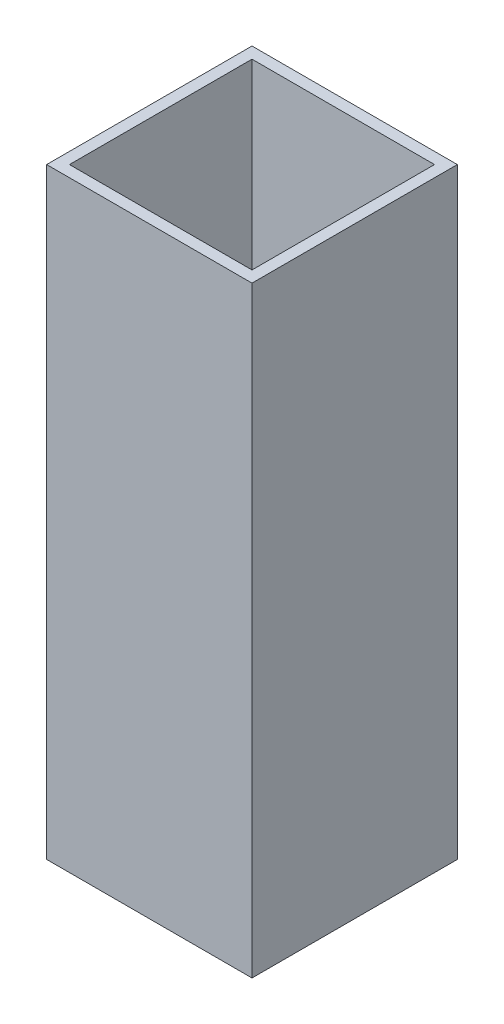
from build123d import *

# Parameters (mm, degrees)
SKETCH1_W            = 36
SKETCH1_H            = 36
SKETCH1_W_2          = 32
SKETCH1_H_2          = 32
BOSS_EXTRUDE1_DEPTH  = 10
SKETCH5_W            = 36
SKETCH5_H            = 36
SKETCH5_W_2          = 32
SKETCH5_H_2          = 32
BOSS_EXTRUDE5_DEPTH  = 63.5
SKETCH2_W            = 36
SKETCH2_H            = 36
SKETCH2_W_2          = 28
SKETCH2_H_2          = 28
BOSS_EXTRUDE9_DEPTH  = 2
SKETCH9_W            = 36
SKETCH9_H            = 36
SKETCH9_W_2          = 32
SKETCH9_H_2          = 32
BOSS_EXTRUDE11_DEPTH = 30


with BuildPart() as part:
    # Sketch1 → Boss-Extrude1 (new body)
    with BuildSketch(Plane(origin=(0, 0, 0), x_dir=(1, 0, 0), z_dir=(0, 1, 0))):
        with Locations((-61.04447382, 32.009277239)):
            Rectangle(SKETCH1_W, SKETCH1_H)
        with Locations((-61.04447382, 32.009277239)):
            Rectangle(SKETCH1_W_2, SKETCH1_H_2, mode=Mode.SUBTRACT)
    extrude(amount=BOSS_EXTRUDE1_DEPTH)

    # Sketch5 → Boss-Extrude5 (add)
    with BuildSketch(Plane(origin=(0, 10, 0), x_dir=(1, 0, 0), z_dir=(0, 1, 0))):
        with Locations((-61.04447382, 32.009277239)):
            Rectangle(SKETCH5_W, SKETCH5_H)
        with Locations((-61.04447382, 32.009277239)):
            Rectangle(SKETCH5_W_2, SKETCH5_H_2, mode=Mode.SUBTRACT)
    extrude(amount=BOSS_EXTRUDE5_DEPTH)

    # Sketch2 → Boss-Extrude9 (add)
    with BuildSketch(Plane.XZ):
        with Locations((-61.04447382, -32.009277239)):
            Rectangle(SKETCH2_W, SKETCH2_H)
        with Locations((-61.04447382, -32.009277239)):
            Rectangle(SKETCH2_W_2, SKETCH2_H_2, mode=Mode.SUBTRACT)
    extrude(amount=BOSS_EXTRUDE9_DEPTH)

    # Sketch9 → Boss-Extrude11 (add)
    with BuildSketch(Plane.XZ.offset(2)):
        with Locations((-61.04447382, -32.009277239)):
            Rectangle(SKETCH9_W, SKETCH9_H)
        with Locations((-61.04447382, -32.009277239)):
            Rectangle(SKETCH9_W_2, SKETCH9_H_2, mode=Mode.SUBTRACT)
    extrude(amount=BOSS_EXTRUDE11_DEPTH)


solid = part.part
